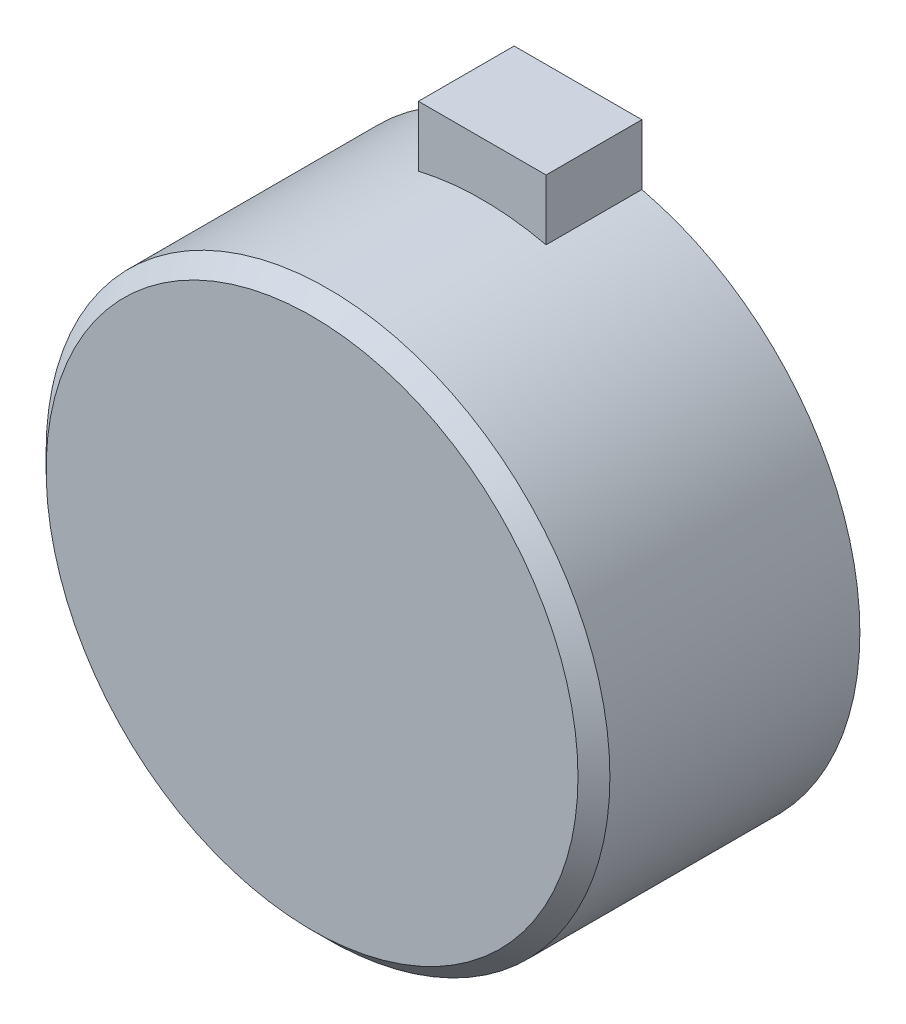
from build123d import *

# Parameters (mm, degrees)
SK_REARHOLE_R           = 1.65
REAR_TAPPED_HOLE_DEPTH  = 8
REAR_HOLE_PATTERN_COUNT = 8
SK_CONNECTOR_W          = 24
SK_CONNECTOR_H          = 14
CONNECTOR_ZONE_DEPTH    = 18


with BuildPart() as part:
    # SK_Body → Housing_Body (revolve)
    with BuildSketch(Plane(origin=(0, 0, 0), x_dir=(1, 0, 0), z_dir=(0, 1, 0))):
        Polygon((0, 0), (50, 0), (53, 3), (53, 50), (50, 50), (0, 50), align=None)
    revolve(axis=Axis((0, 0, 10), (0, 0, -1)))

    # SK_RearHole → Rear_Tapped_Hole (cut)
    with BuildSketch(Plane.XY.offset(-50)):
        with Locations((43, 0)):
            Circle(SK_REARHOLE_R)
    rear_tapped_hole = extrude(amount=REAR_TAPPED_HOLE_DEPTH, mode=Mode.SUBTRACT)

    # Rear_Hole_Pattern: Rear_Tapped_Hole ×8 about axis
    rear_hole_pattern_axis = Axis((0, 0, -52.5), (0, 0, 1))
    for i in range(1, REAR_HOLE_PATTERN_COUNT):
        add(rear_tapped_hole.rotate(rear_hole_pattern_axis, i * 360 / REAR_HOLE_PATTERN_COUNT), mode=Mode.SUBTRACT)

    # SK_Connector → Connector_Zone (add)
    with BuildSketch(Plane.XY.offset(-50)):
        with Locations((0, 56)):
            Rectangle(SK_CONNECTOR_W, SK_CONNECTOR_H)
    extrude(amount=CONNECTOR_ZONE_DEPTH)


solid = part.part
